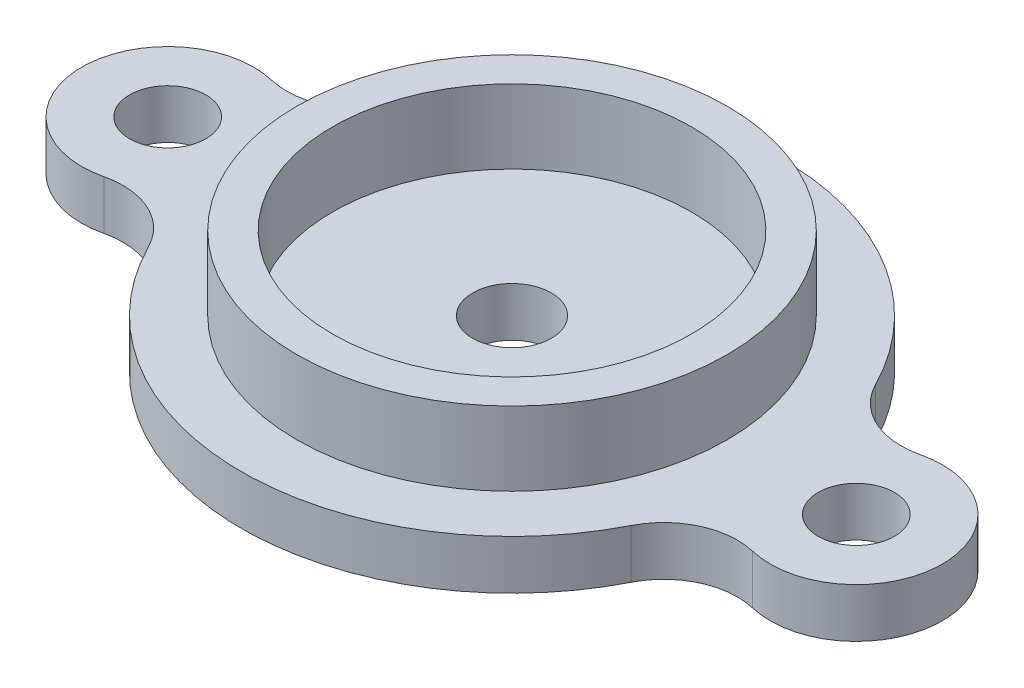
from build123d import *

# Parameters (mm, degrees)
SKETCH_1_R          = 11
EXTRUDE_1_DEPTH     = 2
EXTRUDE_START       = -2
SKETCH_3_R          = 1.55
EXTRUDE_2_DEPTH     = 2
CUT_EXTRUDE_1_REACH = 22.767
SKETCH_4_R          = 1.6
SKETCH_5_R          = 8.75
SKETCH_5_R_2        = 7.3
EXTRUDE_3_DEPTH     = 3


with BuildPart() as part:
    # 草图1 → 凸台-拉伸1 (new body)
    with BuildSketch(Plane(origin=(0, 0, 0), x_dir=(1, 0, 0), z_dir=(0, 1, 0))):
        with Locations(Location((0, 0, 0), (0, 0, 270))):
            Circle(SKETCH_1_R)
    extrude(amount=EXTRUDE_1_DEPTH)

    # 草图3 → 凸台-拉伸2 (add)
    # profile 1 of 2: a face of its own
    with BuildSketch(Plane(origin=(0, 2, 0), x_dir=(1, 0, 0), z_dir=(0, 1, 0)).offset(EXTRUDE_START)):
        with BuildLine():
            ThreePointArc((13.1875, 3.404385958), (11.2296215, 3.600530244), (9.814413265, 4.967624408))
            ThreePointArc((9.814413265, 4.967624408), (11, 0), (9.814413265, -4.967624408))
            ThreePointArc((9.814413265, -4.967624408), (11.2296215, -3.600530244), (13.1875, -3.404385958))
            ThreePointArc((13.1875, -3.404385958), (17.5, 0), (13.1875, 3.404385958))
        make_face()
        with Locations(Location((14, 0, 0), (0, 0, 270))):
            Circle(SKETCH_3_R, mode=Mode.SUBTRACT)
    # profile 2 of 2: a face of its own
    with BuildSketch(Plane(origin=(0, 2, 0), x_dir=(1, 0, 0), z_dir=(0, 1, 0)).offset(EXTRUDE_START)):
        with BuildLine():
            ThreePointArc((-9.814413265, 4.967624408), (-11, 0), (-9.814413265, -4.967624408))
            ThreePointArc((-9.814413265, -4.967624408), (-11.2296215, -3.600530244), (-13.1875, -3.404385958))
            ThreePointArc((-13.1875, -3.404385958), (-17.5, 0), (-13.1875, 3.404385958))
            ThreePointArc((-13.1875, 3.404385958), (-11.2296215, 3.600530244), (-9.814413265, 4.967624408))
        make_face()
        with Locations(Location((-14, 0, 0), (0, 0, 270))):
            Circle(SKETCH_3_R, mode=Mode.SUBTRACT)
    extrude(amount=EXTRUDE_2_DEPTH)

    # 草图4 → 切除-拉伸1 (cut, up to next)
    with BuildSketch(Plane.XZ, mode=Mode.PRIVATE) as cut_extrude_1_sk1:
        with Locations(Location((0, 0, 0), (0, 0, 270))):
            Circle(SKETCH_4_R)
    cut_extrude_1_tool1 = extrude(cut_extrude_1_sk1.sketch, amount=-CUT_EXTRUDE_1_REACH, mode=Mode.PRIVATE) & part.part
    add(cut_extrude_1_tool1.solids().sort_by_distance((0, 0, 0))[0], mode=Mode.SUBTRACT)

    # 草图5 → 凸台-拉伸3 (add)
    with BuildSketch(Plane(origin=(0, 2, 0), x_dir=(1, 0, 0), z_dir=(0, 1, 0))):
        with Locations(Location((0, 0, 0), (0, 0, 270))):
            Circle(SKETCH_5_R)
        with Locations(Location((0, 0, 0), (0, 0, 270))):
            Circle(SKETCH_5_R_2, mode=Mode.SUBTRACT)
    extrude(amount=EXTRUDE_3_DEPTH)


solid = part.part
